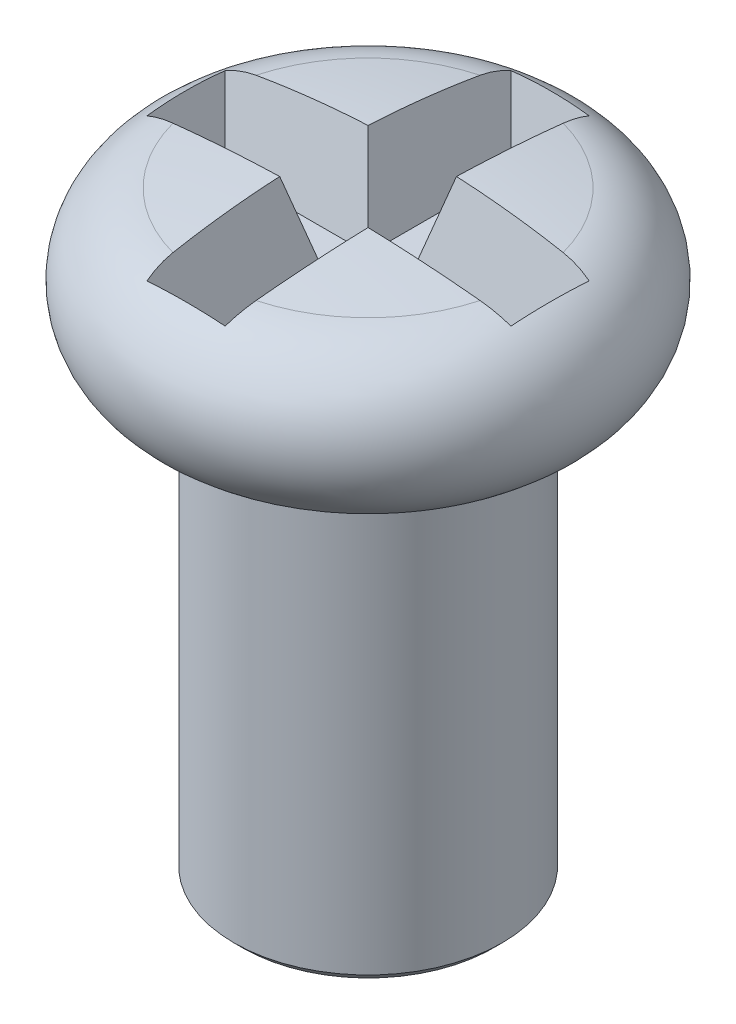
from build123d import *

# Parameters (mm, degrees)
SKETCH_2_W                    = 4.2
SKETCH_2_H                    = 1
CUT_EXTRUDE_1_DEPTH           = 1
CUT_EXTRUDE_1_DRAFT           = -15
SKETCH_2_W_2                  = 1
SKETCH_2_H_2                  = 4.2
CUT_EXTRUDE_1_PROFILE_2_DEPTH = 1
CUT_EXTRUDE_1_PROFILE_2_DRAFT = -15
CHAMFER_1_SIZE                = 0.1


with BuildPart() as part:
    # 草图1 → 旋转1 (revolve)
    with BuildSketch(Plane.XY, mode=Mode.PRIVATE) as revolve_1_sk:
        with BuildLine():
            Line((0, 0), (1.5, 0))
            Line((1.5, 0), (1.5, 5))
            Line((1.5, 5), (2.1, 5))
            ThreePointArc((2.1, 5), (2.533998358, 5.948381153), (1.780839976, 6.669861464))
            ThreePointArc((1.780839976, 6.669861464), (0.892794357, 6.767422046), (0, 6.8))
            Line((0, 6.8), (0, 0))
        make_face()
    revolve(revolve_1_sk.sketch.rotate(Axis((0, 7.002401016, 0), (0, -1, 0)), 90), axis=Axis((0, 7.002401016, 0), (0, -1, 0)))


with BuildPart() as cut_extrude_1_tool:
    # 草图2 → 切除-拉伸1 (with draft: the straight prism first)
    with BuildSketch(Plane(origin=(0, 6.8, 0), x_dir=(1, 0, 0), z_dir=(0, 1, 0))):
        Rectangle(SKETCH_2_W, SKETCH_2_H)
    extrude(amount=-CUT_EXTRUDE_1_DEPTH)
    # 切除-拉伸1: the draft: its side faces are tilted about the plane it starts from
    cut_extrude_1_sides = [cut_extrude_1_tool.faces().sort_by_distance(p)[0] for p in [
        (0, 6.3, 0.5),
        (2.1, 6.3, 0),
        (0, 6.3, -0.5),
        (-2.1, 6.3, 0),
    ]]
    draft(cut_extrude_1_sides, Plane(origin=(0, 6.8, 0), x_dir=(1, 0, 0), z_dir=(0, 1, 0)), CUT_EXTRUDE_1_DRAFT)


with BuildPart() as part_1:
    add(part.part)

    # 切除-拉伸1: cut by cut_extrude_1_tool
    add(cut_extrude_1_tool.part, mode=Mode.SUBTRACT)


with BuildPart() as cut_extrude_1_profile_2_tool:
    # 草图2 → 切除-拉伸1 profile 2 (with draft: the straight prism first)
    with BuildSketch(Plane(origin=(0, 6.8, 0), x_dir=(1, 0, 0), z_dir=(0, 1, 0))):
        Rectangle(SKETCH_2_W_2, SKETCH_2_H_2)
    extrude(amount=-CUT_EXTRUDE_1_PROFILE_2_DEPTH)
    # 切除-拉伸1 profile 2: the draft: its side faces are tilted about the plane it starts from
    cut_extrude_1_profile_2_sides = [cut_extrude_1_profile_2_tool.faces().sort_by_distance(p)[0] for p in [
        (0, 6.3, 2.1),
        (0.5, 6.3, 0),
        (0, 6.3, -2.1),
        (-0.5, 6.3, 0),
    ]]
    draft(cut_extrude_1_profile_2_sides, Plane(origin=(0, 6.8, 0), x_dir=(1, 0, 0), z_dir=(0, 1, 0)), CUT_EXTRUDE_1_PROFILE_2_DRAFT)


with BuildPart() as part_2:
    add(part_1.part)

    # 切除-拉伸1 profile 2: cut by cut_extrude_1_profile_2_tool
    add(cut_extrude_1_profile_2_tool.part, mode=Mode.SUBTRACT)

    # 倒角1
    chamfer_1_edges = [part_2.edges().sort_by_distance(p)[0] for p in [
        (0, 0, -1.5),
    ]]
    chamfer(chamfer_1_edges, length=CHAMFER_1_SIZE)


solid = part_2.part
